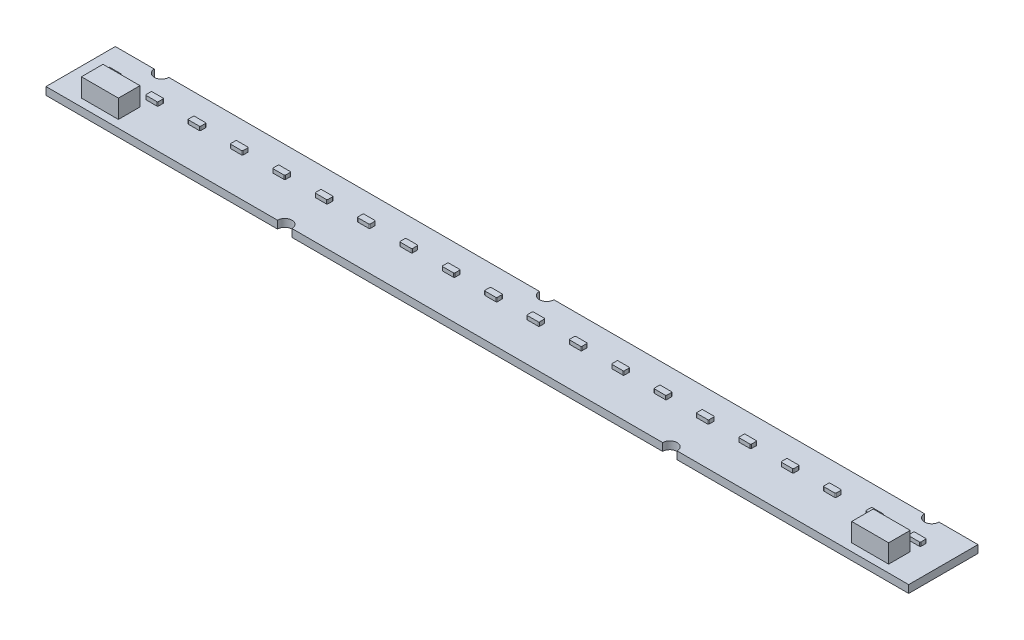
from build123d import *

# Parameters (mm, degrees)
CROQUIS1_W              = 280
CROQUIS1_H              = 22.5
SALIENTE_EXTRUIR1_DEPTH = 2.5
CORTAR_EXTRUIR1_REACH   = 142.474
SALIENTE_EXTRUIR2_DEPTH = 1.25
CROQUIS4_W              = 12
CROQUIS4_H              = 7
SALIENTE_EXTRUIR3_DEPTH = 6


with BuildPart() as part:
    # Croquis1 → Saliente-Extruir1 (new body)
    with BuildSketch(Plane(origin=(0, 0, 0), x_dir=(1, 0, 0), z_dir=(0, 1, 0))):
        Rectangle(CROQUIS1_W, CROQUIS1_H)
    extrude(amount=SALIENTE_EXTRUIR1_DEPTH)

    # Croquis2 → Cortar-Extruir1 (cut, up to next)
    with BuildSketch(Plane(origin=(0, 2.5, 0), x_dir=(1, 0, 0), z_dir=(0, 1, 0)), mode=Mode.PRIVATE) as cortar_extruir1_sk1:
        with BuildLine():
            Line((-127.35, 11.25), (-122.65, 11.25))
            ThreePointArc((-122.65, 11.25), (-125, 8.9), (-127.35, 11.25))
        make_face()
    cortar_extruir1_tool1 = extrude(cortar_extruir1_sk1.sketch, amount=-CORTAR_EXTRUIR1_REACH, mode=Mode.PRIVATE) & part.part
    # Croquis2 → Cortar-Extruir1 (cut, up to next)
    with BuildSketch(Plane(origin=(0, 2.5, 0), x_dir=(1, 0, 0), z_dir=(0, 1, 0)), mode=Mode.PRIVATE) as cortar_extruir1_sk2:
        with BuildLine():
            Line((-64.85, -11.25), (-60.15, -11.25))
            ThreePointArc((-60.15, -11.25), (-62.5, -8.9), (-64.85, -11.25))
        make_face()
    cortar_extruir1_tool2 = extrude(cortar_extruir1_sk2.sketch, amount=-CORTAR_EXTRUIR1_REACH, mode=Mode.PRIVATE) & part.part
    # Croquis2 → Cortar-Extruir1 (cut, up to next)
    with BuildSketch(Plane(origin=(0, 2.5, 0), x_dir=(1, 0, 0), z_dir=(0, 1, 0)), mode=Mode.PRIVATE) as cortar_extruir1_sk3:
        with BuildLine():
            Line((60.15, -11.25), (64.85, -11.25))
            ThreePointArc((64.85, -11.25), (62.5, -8.9), (60.15, -11.25))
        make_face()
    cortar_extruir1_tool3 = extrude(cortar_extruir1_sk3.sketch, amount=-CORTAR_EXTRUIR1_REACH, mode=Mode.PRIVATE) & part.part
    # Croquis2 → Cortar-Extruir1 (cut, up to next)
    with BuildSketch(Plane(origin=(0, 2.5, 0), x_dir=(1, 0, 0), z_dir=(0, 1, 0)), mode=Mode.PRIVATE) as cortar_extruir1_sk4:
        with BuildLine():
            Line((-2.35, 11.25), (2.35, 11.25))
            ThreePointArc((2.35, 11.25), (0, 8.9), (-2.35, 11.25))
        make_face()
    cortar_extruir1_tool4 = extrude(cortar_extruir1_sk4.sketch, amount=-CORTAR_EXTRUIR1_REACH, mode=Mode.PRIVATE) & part.part
    # Croquis2 → Cortar-Extruir1 (cut, up to next)
    with BuildSketch(Plane(origin=(0, 2.5, 0), x_dir=(1, 0, 0), z_dir=(0, 1, 0)), mode=Mode.PRIVATE) as cortar_extruir1_sk5:
        with BuildLine():
            Line((122.65, 11.25), (127.35, 11.25))
            ThreePointArc((127.35, 11.25), (125, 8.9), (122.65, 11.25))
        make_face()
    cortar_extruir1_tool5 = extrude(cortar_extruir1_sk5.sketch, amount=-CORTAR_EXTRUIR1_REACH, mode=Mode.PRIVATE) & part.part
    add(cortar_extruir1_tool1.solids().sort_by_distance((-125, 2.5, -10.252629))[0], mode=Mode.SUBTRACT)
    add(cortar_extruir1_tool2.solids().sort_by_distance((-62.5, 2.5, 10.252629))[0], mode=Mode.SUBTRACT)
    add(cortar_extruir1_tool3.solids().sort_by_distance((62.5, 2.5, 10.252629))[0], mode=Mode.SUBTRACT)
    add(cortar_extruir1_tool4.solids().sort_by_distance((0, 2.5, -10.252629))[0], mode=Mode.SUBTRACT)
    add(cortar_extruir1_tool5.solids().sort_by_distance((125, 2.5, -10.252629))[0], mode=Mode.SUBTRACT)

    # Croquis3 → Saliente-Extruir2 (add)
    with BuildSketch(Plane(origin=(0, 2.5, 0), x_dir=(1, 0, 0), z_dir=(0, 1, 0))):
        with BuildLine():
            Line((-133.75, 3.25), (-130.25, 3.25))
            ThreePointArc((-130.25, 3.25), (-130.073223305, 3.176776695), (-130, 3))
            Line((-130, 3), (-130, 1.5))
            ThreePointArc((-130, 1.5), (-130.073223305, 1.323223305), (-130.25, 1.25))
            Line((-130.25, 1.25), (-133.75, 1.25))
            ThreePointArc((-133.75, 1.25), (-133.926776695, 1.323223305), (-134, 1.5))
            Line((-134, 1.5), (-134, 3))
            ThreePointArc((-134, 3), (-133.926776695, 3.176776695), (-133.75, 3.25))
        make_face()
        with BuildLine():
            Line((-120, 1.25), (-116.5, 1.25))
            ThreePointArc((-116.5, 1.25), (-116.323223305, 1.323223305), (-116.25, 1.5))
            Line((-116.25, 1.5), (-116.25, 3))
            ThreePointArc((-116.25, 3), (-116.323223305, 3.176776695), (-116.5, 3.25))
            Line((-116.5, 3.25), (-120, 3.25))
            ThreePointArc((-120, 3.25), (-120.176776695, 3.176776695), (-120.25, 3))
            Line((-120.25, 3), (-120.25, 1.5))
            ThreePointArc((-120.25, 1.5), (-120.176776695, 1.323223305), (-120, 1.25))
        make_face()
        with BuildLine():
            Line((-106.25, 1.25), (-102.75, 1.25))
            ThreePointArc((-102.75, 1.25), (-102.573223305, 1.323223305), (-102.5, 1.5))
            Line((-102.5, 1.5), (-102.5, 3))
            ThreePointArc((-102.5, 3), (-102.573223305, 3.176776695), (-102.75, 3.25))
            Line((-102.75, 3.25), (-106.25, 3.25))
            ThreePointArc((-106.25, 3.25), (-106.426776695, 3.176776695), (-106.5, 3))
            Line((-106.5, 3), (-106.5, 1.5))
            ThreePointArc((-106.5, 1.5), (-106.426776695, 1.323223305), (-106.25, 1.25))
        make_face()
        with BuildLine():
            Line((-92.5, 1.25), (-89, 1.25))
            ThreePointArc((-89, 1.25), (-88.823223305, 1.323223305), (-88.75, 1.5))
            Line((-88.75, 1.5), (-88.75, 3))
            ThreePointArc((-88.75, 3), (-88.823223305, 3.176776695), (-89, 3.25))
            Line((-89, 3.25), (-92.5, 3.25))
            ThreePointArc((-92.5, 3.25), (-92.676776695, 3.176776695), (-92.75, 3))
            Line((-92.75, 3), (-92.75, 1.5))
            ThreePointArc((-92.75, 1.5), (-92.676776695, 1.323223305), (-92.5, 1.25))
        make_face()
        with BuildLine():
            Line((-78.75, 1.25), (-75.25, 1.25))
            ThreePointArc((-75.25, 1.25), (-75.073223305, 1.323223305), (-75, 1.5))
            Line((-75, 1.5), (-75, 3))
            ThreePointArc((-75, 3), (-75.073223305, 3.176776695), (-75.25, 3.25))
            Line((-75.25, 3.25), (-78.75, 3.25))
            ThreePointArc((-78.75, 3.25), (-78.926776695, 3.176776695), (-79, 3))
            Line((-79, 3), (-79, 1.5))
            ThreePointArc((-79, 1.5), (-78.926776695, 1.323223305), (-78.75, 1.25))
        make_face()
        with BuildLine():
            Line((-65, 1.25), (-61.5, 1.25))
            ThreePointArc((-61.5, 1.25), (-61.323223305, 1.323223305), (-61.25, 1.5))
            Line((-61.25, 1.5), (-61.25, 3))
            ThreePointArc((-61.25, 3), (-61.323223305, 3.176776695), (-61.5, 3.25))
            Line((-61.5, 3.25), (-65, 3.25))
            ThreePointArc((-65, 3.25), (-65.176776695, 3.176776695), (-65.25, 3))
            Line((-65.25, 3), (-65.25, 1.5))
            ThreePointArc((-65.25, 1.5), (-65.176776695, 1.323223305), (-65, 1.25))
        make_face()
        with BuildLine():
            Line((-51.25, 1.25), (-47.75, 1.25))
            ThreePointArc((-47.75, 1.25), (-47.573223305, 1.323223305), (-47.5, 1.5))
            Line((-47.5, 1.5), (-47.5, 3))
            ThreePointArc((-47.5, 3), (-47.573223305, 3.176776695), (-47.75, 3.25))
            Line((-47.75, 3.25), (-51.25, 3.25))
            ThreePointArc((-51.25, 3.25), (-51.426776695, 3.176776695), (-51.5, 3))
            Line((-51.5, 3), (-51.5, 1.5))
            ThreePointArc((-51.5, 1.5), (-51.426776695, 1.323223305), (-51.25, 1.25))
        make_face()
        with BuildLine():
            Line((-37.5, 1.25), (-34, 1.25))
            ThreePointArc((-34, 1.25), (-33.823223305, 1.323223305), (-33.75, 1.5))
            Line((-33.75, 1.5), (-33.75, 3))
            ThreePointArc((-33.75, 3), (-33.823223305, 3.176776695), (-34, 3.25))
            Line((-34, 3.25), (-37.5, 3.25))
            ThreePointArc((-37.5, 3.25), (-37.676776695, 3.176776695), (-37.75, 3))
            Line((-37.75, 3), (-37.75, 1.5))
            ThreePointArc((-37.75, 1.5), (-37.676776695, 1.323223305), (-37.5, 1.25))
        make_face()
        with BuildLine():
            Line((-23.75, 1.25), (-20.25, 1.25))
            ThreePointArc((-20.25, 1.25), (-20.073223305, 1.323223305), (-20, 1.5))
            Line((-20, 1.5), (-20, 3))
            ThreePointArc((-20, 3), (-20.073223305, 3.176776695), (-20.25, 3.25))
            Line((-20.25, 3.25), (-23.75, 3.25))
            ThreePointArc((-23.75, 3.25), (-23.926776695, 3.176776695), (-24, 3))
            Line((-24, 3), (-24, 1.5))
            ThreePointArc((-24, 1.5), (-23.926776695, 1.323223305), (-23.75, 1.25))
        make_face()
        with BuildLine():
            Line((-10, 1.25), (-6.5, 1.25))
            ThreePointArc((-6.5, 1.25), (-6.323223305, 1.323223305), (-6.25, 1.5))
            Line((-6.25, 1.5), (-6.25, 3))
            ThreePointArc((-6.25, 3), (-6.323223305, 3.176776695), (-6.5, 3.25))
            Line((-6.5, 3.25), (-10, 3.25))
            ThreePointArc((-10, 3.25), (-10.176776695, 3.176776695), (-10.25, 3))
            Line((-10.25, 3), (-10.25, 1.5))
            ThreePointArc((-10.25, 1.5), (-10.176776695, 1.323223305), (-10, 1.25))
        make_face()
        with BuildLine():
            Line((3.75, 1.25), (7.25, 1.25))
            ThreePointArc((7.25, 1.25), (7.426776695, 1.323223305), (7.5, 1.5))
            Line((7.5, 1.5), (7.5, 3))
            ThreePointArc((7.5, 3), (7.426776695, 3.176776695), (7.25, 3.25))
            Line((7.25, 3.25), (3.75, 3.25))
            ThreePointArc((3.75, 3.25), (3.573223305, 3.176776695), (3.5, 3))
            Line((3.5, 3), (3.5, 1.5))
            ThreePointArc((3.5, 1.5), (3.573223305, 1.323223305), (3.75, 1.25))
        make_face()
        with BuildLine():
            Line((17.5, 1.25), (21, 1.25))
            ThreePointArc((21, 1.25), (21.176776695, 1.323223305), (21.25, 1.5))
            Line((21.25, 1.5), (21.25, 3))
            ThreePointArc((21.25, 3), (21.176776695, 3.176776695), (21, 3.25))
            Line((21, 3.25), (17.5, 3.25))
            ThreePointArc((17.5, 3.25), (17.323223305, 3.176776695), (17.25, 3))
            Line((17.25, 3), (17.25, 1.5))
            ThreePointArc((17.25, 1.5), (17.323223305, 1.323223305), (17.5, 1.25))
        make_face()
        with BuildLine():
            Line((31.25, 1.25), (34.75, 1.25))
            ThreePointArc((34.75, 1.25), (34.926776695, 1.323223305), (35, 1.5))
            Line((35, 1.5), (35, 3))
            ThreePointArc((35, 3), (34.926776695, 3.176776695), (34.75, 3.25))
            Line((34.75, 3.25), (31.25, 3.25))
            ThreePointArc((31.25, 3.25), (31.073223305, 3.176776695), (31, 3))
            Line((31, 3), (31, 1.5))
            ThreePointArc((31, 1.5), (31.073223305, 1.323223305), (31.25, 1.25))
        make_face()
        with BuildLine():
            Line((45, 1.25), (48.5, 1.25))
            ThreePointArc((48.5, 1.25), (48.676776695, 1.323223305), (48.75, 1.5))
            Line((48.75, 1.5), (48.75, 3))
            ThreePointArc((48.75, 3), (48.676776695, 3.176776695), (48.5, 3.25))
            Line((48.5, 3.25), (45, 3.25))
            ThreePointArc((45, 3.25), (44.823223305, 3.176776695), (44.75, 3))
            Line((44.75, 3), (44.75, 1.5))
            ThreePointArc((44.75, 1.5), (44.823223305, 1.323223305), (45, 1.25))
        make_face()
        with BuildLine():
            Line((58.75, 1.25), (62.25, 1.25))
            ThreePointArc((62.25, 1.25), (62.426776695, 1.323223305), (62.5, 1.5))
            Line((62.5, 1.5), (62.5, 3))
            ThreePointArc((62.5, 3), (62.426776695, 3.176776695), (62.25, 3.25))
            Line((62.25, 3.25), (58.75, 3.25))
            ThreePointArc((58.75, 3.25), (58.573223305, 3.176776695), (58.5, 3))
            Line((58.5, 3), (58.5, 1.5))
            ThreePointArc((58.5, 1.5), (58.573223305, 1.323223305), (58.75, 1.25))
        make_face()
        with BuildLine():
            Line((72.5, 1.25), (76, 1.25))
            ThreePointArc((76, 1.25), (76.176776695, 1.323223305), (76.25, 1.5))
            Line((76.25, 1.5), (76.25, 3))
            ThreePointArc((76.25, 3), (76.176776695, 3.176776695), (76, 3.25))
            Line((76, 3.25), (72.5, 3.25))
            ThreePointArc((72.5, 3.25), (72.323223305, 3.176776695), (72.25, 3))
            Line((72.25, 3), (72.25, 1.5))
            ThreePointArc((72.25, 1.5), (72.323223305, 1.323223305), (72.5, 1.25))
        make_face()
        with BuildLine():
            Line((86.25, 1.25), (89.75, 1.25))
            ThreePointArc((89.75, 1.25), (89.926776695, 1.323223305), (90, 1.5))
            Line((90, 1.5), (90, 3))
            ThreePointArc((90, 3), (89.926776695, 3.176776695), (89.75, 3.25))
            Line((89.75, 3.25), (86.25, 3.25))
            ThreePointArc((86.25, 3.25), (86.073223305, 3.176776695), (86, 3))
            Line((86, 3), (86, 1.5))
            ThreePointArc((86, 1.5), (86.073223305, 1.323223305), (86.25, 1.25))
        make_face()
        with BuildLine():
            Line((100, 1.25), (103.5, 1.25))
            ThreePointArc((103.5, 1.25), (103.676776695, 1.323223305), (103.75, 1.5))
            Line((103.75, 1.5), (103.75, 3))
            ThreePointArc((103.75, 3), (103.676776695, 3.176776695), (103.5, 3.25))
            Line((103.5, 3.25), (100, 3.25))
            ThreePointArc((100, 3.25), (99.823223305, 3.176776695), (99.75, 3))
            Line((99.75, 3), (99.75, 1.5))
            ThreePointArc((99.75, 1.5), (99.823223305, 1.323223305), (100, 1.25))
        make_face()
        with BuildLine():
            Line((113.75, 1.25), (117.25, 1.25))
            ThreePointArc((117.25, 1.25), (117.426776695, 1.323223305), (117.5, 1.5))
            Line((117.5, 1.5), (117.5, 3))
            ThreePointArc((117.5, 3), (117.426776695, 3.176776695), (117.25, 3.25))
            Line((117.25, 3.25), (113.75, 3.25))
            ThreePointArc((113.75, 3.25), (113.573223305, 3.176776695), (113.5, 3))
            Line((113.5, 3), (113.5, 1.5))
            ThreePointArc((113.5, 1.5), (113.573223305, 1.323223305), (113.75, 1.25))
        make_face()
        with BuildLine():
            Line((127.5, 1.25), (131, 1.25))
            ThreePointArc((131, 1.25), (131.176776695, 1.323223305), (131.25, 1.5))
            Line((131.25, 1.5), (131.25, 3))
            ThreePointArc((131.25, 3), (131.176776695, 3.176776695), (131, 3.25))
            Line((131, 3.25), (127.5, 3.25))
            ThreePointArc((127.5, 3.25), (127.323223305, 3.176776695), (127.25, 3))
            Line((127.25, 3), (127.25, 1.5))
            ThreePointArc((127.25, 1.5), (127.323223305, 1.323223305), (127.5, 1.25))
        make_face()
    extrude(amount=SALIENTE_EXTRUIR2_DEPTH)

    # Croquis4 → Saliente-Extruir3 (add)
    with BuildSketch(Plane(origin=(0, 2.5, 0), x_dir=(1, 0, 0), z_dir=(0, 1, 0))):
        with Locations((-125, -5.25)):
            Rectangle(CROQUIS4_W, CROQUIS4_H)
    saliente_extruir3 = extrude(amount=SALIENTE_EXTRUIR3_DEPTH)

    # Simetría1: Saliente-Extruir3 across plane
    add(saliente_extruir3.mirror(Plane(origin=(0, 0, 0), x_dir=(0, 0, 1), z_dir=(1, 0, 0))))


solid = part.part
